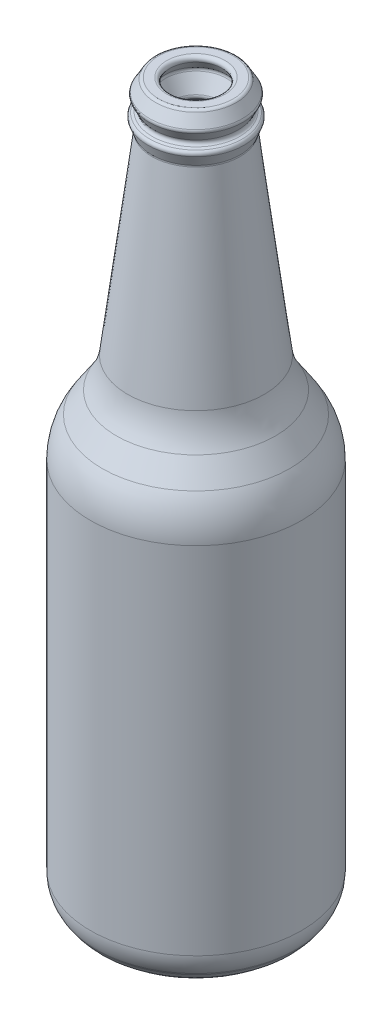
from build123d import *

# Parameters (mm, degrees)
SHELL1_T  = -4
FILLET1_R = 20
FILLET2_R = 10
FILLET3_R = 1
FILLET4_R = 1


with BuildPart() as part:
    # Sketch3 → Revolve1 (revolve)
    with BuildSketch(Plane.XY, mode=Mode.PRIVATE) as revolve1_sk:
        Polygon((11.168891971, 127.791737032), (13.5, 123.791737032), (11.5, 119.916737032), (14, 118.791737032), (12.5, 114.791737032), (20, 54.791737032), (30, 39.791737032), (30, -70.208262968), (25, -77.708262968), (0, -77.708262968), (0, 127.791737032), align=None)
    revolve(revolve1_sk.sketch.rotate(Axis((0, 127.791737032, 0), (0, -1, 0)), 180), axis=Axis((0, 127.791737032, 0), (0, -1, 0)))

    # Shell1
    shell1_openings = [part.faces().sort_by_distance(p)[0] for p in [
        (0, 127.791737032, 0),
    ]]
    offset(amount=SHELL1_T, openings=shell1_openings, kind=Kind.INTERSECTION)

    # Fillet1
    fillet1_edges = [part.edges().sort_by_distance(p)[0] for p in [
        (30, 39.791737032, 0),
        (20, 54.791737032, 0),
    ]]
    fillet(fillet1_edges, radius=FILLET1_R)

    # Fillet2
    fillet2_edges = [part.edges().sort_by_distance(p)[0] for p in [
        (25, -77.708262968, 0),
        (30, -70.208262968, 0),
    ]]
    fillet(fillet2_edges, radius=FILLET2_R)

    # Fillet3
    fillet3_edges = [part.edges().sort_by_distance(p)[0] for p in [
        (12.5, 114.791737032, 0),
        (14, 118.791737032, 0),
        (11.5, 119.916737032, 0),
        (13.5, 123.791737032, 0),
        (11.168891971, 127.791737032, 0),
    ]]
    fillet(fillet3_edges, radius=FILLET3_R)

    # Fillet4
    fillet4_edges = [part.edges().sort_by_distance(p)[0] for p in [
        (6.539198176, 127.791737032, 0),
        (8.938365669, 123.674952287, 0),
        (6.009853734, 118.000960412, 0),
    ]]
    fillet(fillet4_edges, radius=FILLET4_R)


solid = part.part
